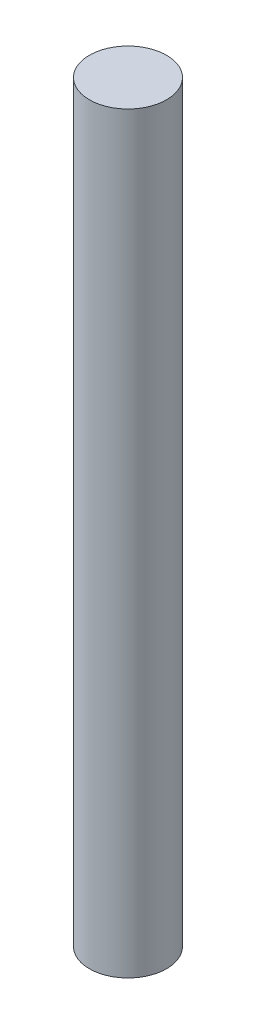
from build123d import *

# Parameters (mm, degrees)
SKETCH1_R           = 2
BOSS_EXTRUDE1_DEPTH = 39


with BuildPart() as part:
    # Sketch1 → Boss-Extrude1 (new body)
    with BuildSketch(Plane(origin=(0, 0, 0), x_dir=(1, 0, 0), z_dir=(0, 1, 0))):
        with Locations(Location((0, 0, 0), (0, 0, 270))):
            Circle(SKETCH1_R)
    extrude(amount=BOSS_EXTRUDE1_DEPTH)


solid = part.part
